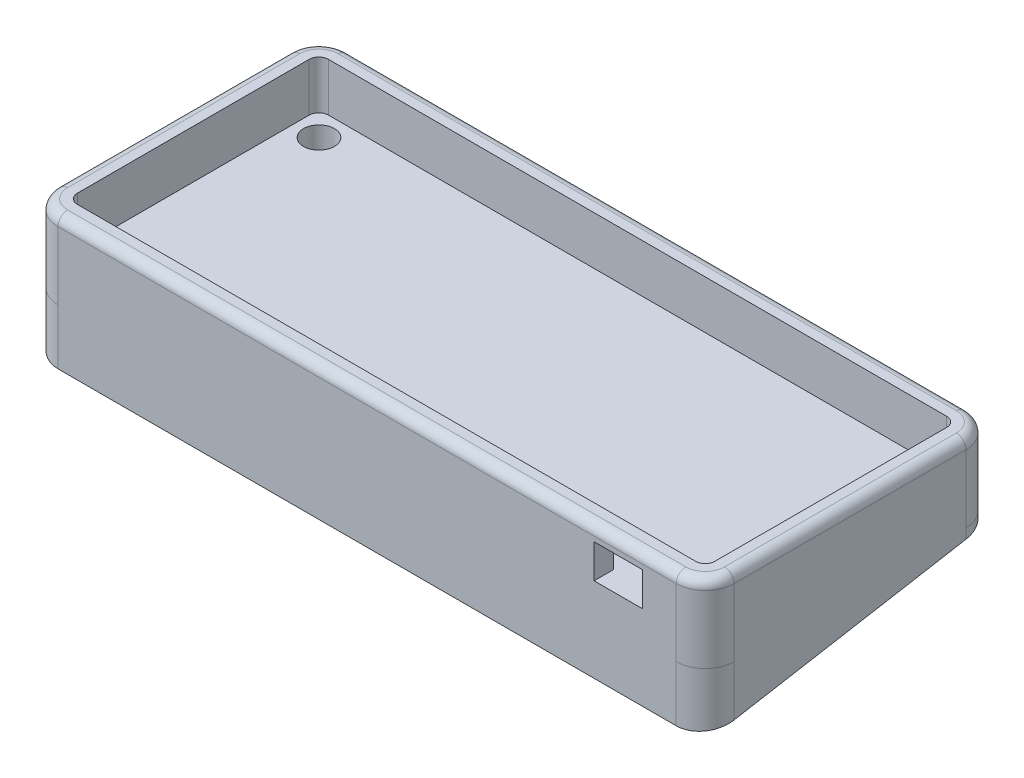
from build123d import *

# Parameters (mm, degrees)
BOSS_EXTRUDE1_DEPTH = 16
SKETCH2_R           = 3.2
BOSS_EXTRUDE2_DEPTH = 6
SKETCH3_W           = 10
SKETCH3_H           = 7
CUT_EXTRUDE1_DEPTH  = 28
FILLET2_R           = 2
BOSS_EXTRUDE3_DEPTH = 140
FILLET3_R           = 6


with BuildPart() as part:
    # Sketch1 → Boss-Extrude1 (new body)
    with BuildSketch(Plane(origin=(0, 0, 0), x_dir=(1, 0, 0), z_dir=(0, 1, 0))):
        with BuildLine():
            Line((-61.663716814, 44.495575221), (66.336283186, 44.495575221))
            ThreePointArc((66.336283186, 44.495575221), (70.578923873, 42.738215908), (72.336283186, 38.495575221))
            Line((72.336283186, 38.495575221), (72.336283186, -9.504424779))
            ThreePointArc((72.336283186, -9.504424779), (70.578923873, -13.747065466), (66.336283186, -15.504424779))
            Line((66.336283186, -15.504424779), (-61.663716814, -15.504424779))
            ThreePointArc((-61.663716814, -15.504424779), (-65.906357501, -13.747065466), (-67.663716814, -9.504424779))
            Line((-67.663716814, -9.504424779), (-67.663716814, 38.495575221))
            ThreePointArc((-67.663716814, 38.495575221), (-65.906357501, 42.738215908), (-61.663716814, 44.495575221))
        make_face()
        with BuildLine():
            Line((-61.663716814, 40.495575221), (66.336283186, 40.495575221))
            ThreePointArc((66.336283186, 40.495575221), (67.750496748, 39.909788784), (68.336283186, 38.495575221))
            Line((68.336283186, 38.495575221), (68.336283186, -9.504424779))
            ThreePointArc((68.336283186, -9.504424779), (67.750496748, -10.918638341), (66.336283186, -11.504424779))
            Line((66.336283186, -11.504424779), (-61.663716814, -11.504424779))
            ThreePointArc((-61.663716814, -11.504424779), (-63.077930377, -10.918638341), (-63.663716814, -9.504424779))
            Line((-63.663716814, -9.504424779), (-63.663716814, 38.495575221))
            ThreePointArc((-63.663716814, 38.495575221), (-63.077930377, 39.909788784), (-61.663716814, 40.495575221))
        make_face(mode=Mode.SUBTRACT)
    extrude(amount=BOSS_EXTRUDE1_DEPTH)

    # Sketch2 → Boss-Extrude2 (add)
    with BuildSketch(Plane(origin=(0, 0, 0), x_dir=(1, 0, 0), z_dir=(0, 1, 0))):
        with BuildLine():
            Line((-61.663716814, 40.495575221), (66.336283186, 40.495575221))
            ThreePointArc((66.336283186, 40.495575221), (67.750496748, 39.909788784), (68.336283186, 38.495575221))
            Line((68.336283186, 38.495575221), (68.336283186, -9.504424779))
            ThreePointArc((68.336283186, -9.504424779), (67.750496748, -10.918638341), (66.336283186, -11.504424779))
            Line((66.336283186, -11.504424779), (-61.663716814, -11.504424779))
            ThreePointArc((-61.663716814, -11.504424779), (-63.077930377, -10.918638341), (-63.663716814, -9.504424779))
            Line((-63.663716814, -9.504424779), (-63.663716814, 38.495575221))
            ThreePointArc((-63.663716814, 38.495575221), (-63.077930377, 39.909788784), (-61.663716814, 40.495575221))
        make_face()
        with Locations(Location((-58.62788409, 35.495575221, 0), (0, 0, 270))):
            Circle(SKETCH2_R, mode=Mode.SUBTRACT)
        with Locations(Location((63.300450462, 35.495575221, 0), (0, 0, 90))):
            Circle(SKETCH2_R, mode=Mode.SUBTRACT)
        with Locations(Location((-58.62788409, -6.504424779, 0), (0, 0, 90))):
            Circle(SKETCH2_R, mode=Mode.SUBTRACT)
    extrude(amount=BOSS_EXTRUDE2_DEPTH)

    # Sketch3 → Cut-Extrude1 (cut)
    with BuildSketch(Plane.XY):
        with Locations((54.336283186, 9.5)):
            Rectangle(SKETCH3_W, SKETCH3_H)
    extrude(amount=CUT_EXTRUDE1_DEPTH, mode=Mode.SUBTRACT)

    # Fillet2
    fillet2_edges = [part.edges().sort_by_distance(p)[0] for p in [
        (-65.906357501, 16, -42.738215908),
        (-67.663716814, 16, -14.495575221),
        (-65.906357501, 16, 13.747065466),
        (2.336283186, 16, 15.504424779),
        (70.578923873, 16, 13.747065466),
        (72.336283186, 16, -14.495575221),
        (70.578923873, 16, -42.738215908),
        (2.336283186, 16, -44.495575221),
    ]]
    fillet(fillet2_edges, radius=FILLET2_R)

    # Sketch4 → Boss-Extrude3 (add)
    with BuildSketch(Plane(origin=(72.336283186, 0, 0), x_dir=(0, 0, -1), z_dir=(1, 0, 0))):
        Polygon((-15.504424779, 0), (-15.504424779, -11.5), (44.495575221, -1), (44.495575221, 0), align=None)
    extrude(amount=-BOSS_EXTRUDE3_DEPTH)

    # Fillet3
    fillet3_edges = [part.edges().sort_by_distance(p)[0] for p in [
        (-67.663716814, -5.75, 15.504424779),
        (72.336283186, -5.75, 15.504424779),
        (-67.663716814, -0.5, -44.495575221),
        (72.336283186, -0.5, -44.495575221),
    ]]
    fillet(fillet3_edges, radius=FILLET3_R)


solid = part.part
